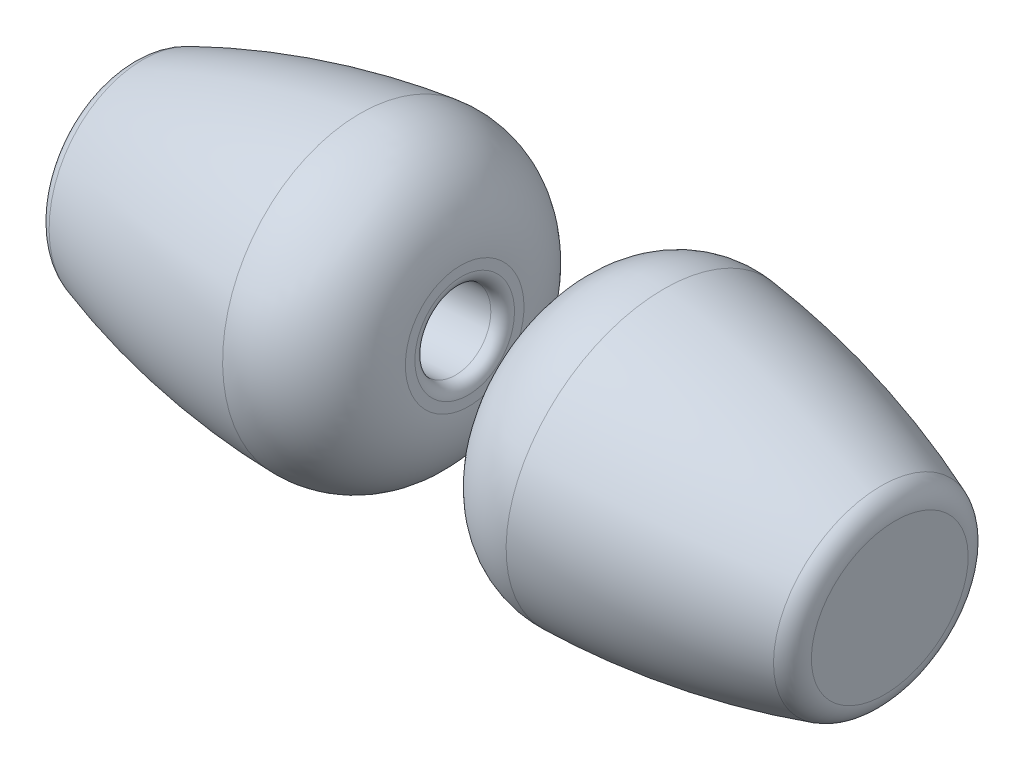
from build123d import *

# Parameters (mm, degrees)
FILLET1_R        = 1
SKETCH10_R       = 1.6
EXTRUDECUT_DEPTH = 10
FILLET2_R        = 0.5


with BuildPart() as part:
    # sketch9 → revolve1 (revolve)
    with BuildSketch(Plane.XY):
        with BuildLine():
            Line((2, 157.811076058), (2.172690038, 160.305104556))
            ThreePointArc((2.172690038, 160.305104556), (3.548041005, 162.949346806), (6.420443791, 163.744902958))
            ThreePointArc((6.420443791, 163.744902958), (11.439366208, 162.653197494), (16.242863651, 160.834457444))
            Line((16.242863651, 160.834457444), (15.966559591, 156.844011847))
            Line((15.966559591, 156.844011847), (2, 157.811076058))
        make_face()
    revolve(axis=Axis((15.966559591, 156.844011847, 0), (-0.9976113993662253, 0.06907601504546812, 0)))

    # fillet1
    fillet1_edges = [part.edges().sort_by_distance(p)[0] for p in [
        (15.690255531, 152.853566249, 0),
    ]]
    fillet(fillet1_edges, radius=FILLET1_R)

    # sketch10 → extrudecut (cut)
    with BuildSketch(Plane(origin=(-8.884465215, 0.615172855, 0), x_dir=(0, 0, 1), z_dir=(-0.9976113993662253, 0.06907601504546812, 0))):
        with Locations(Location((0, 157.572280451, 0), (0, 0, 270))):
            Circle(SKETCH10_R)
    extrude(amount=-EXTRUDECUT_DEPTH, mode=Mode.SUBTRACT)

    # fillet2
    fillet2_edges = [part.edges().sort_by_distance(p)[0] for p in [
        (2.110521624, 159.407254297, 0),
    ]]
    fillet(fillet2_edges, radius=FILLET2_R)


with BuildPart() as body_2:
    # simetric: mirrored copy
    add(part.part.mirror(Plane(origin=(0, 0, 0), x_dir=(0, 0, 1), z_dir=(1, 0, 0))))


solid = Compound([part.part, body_2.part])
